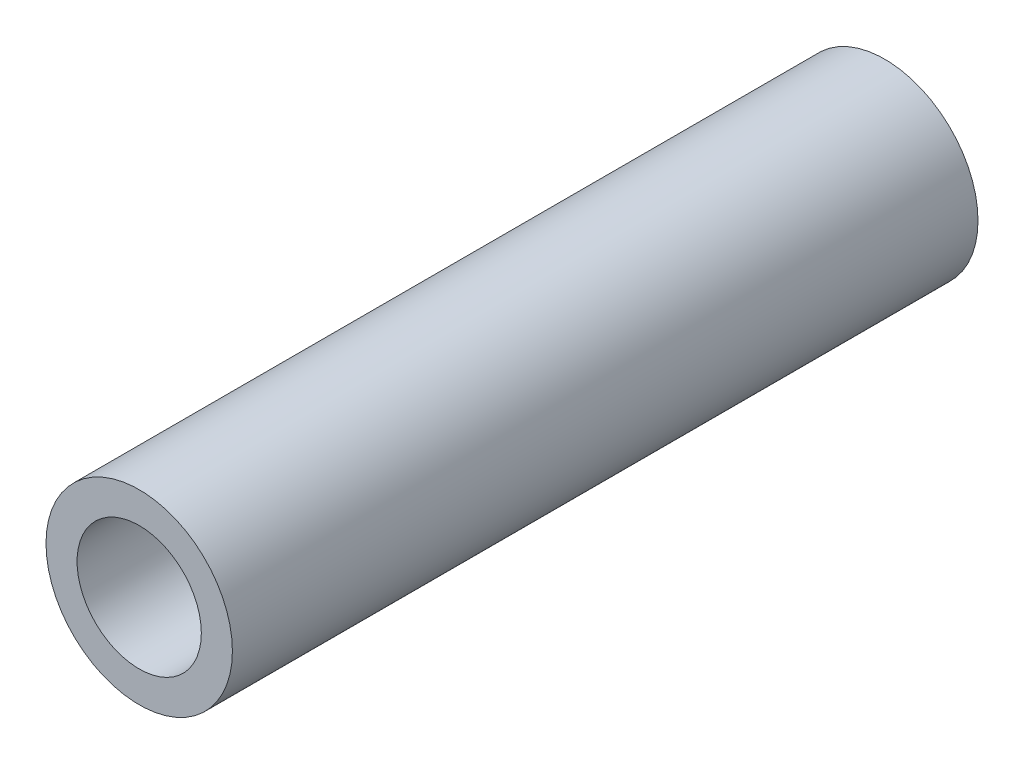
from build123d import *

# Parameters (mm, degrees)
SKETCH1_R      = 38.1
SKETCH1_R_2    = 25.4
EXTRUDE1_DEPTH = 304.8


with BuildPart() as part:
    # Sketch1 → Extrude1 (new body)
    with BuildSketch(Plane.XY):
        Circle(SKETCH1_R)
        Circle(SKETCH1_R_2, mode=Mode.SUBTRACT)
    extrude(amount=-EXTRUDE1_DEPTH)


solid = part.part
